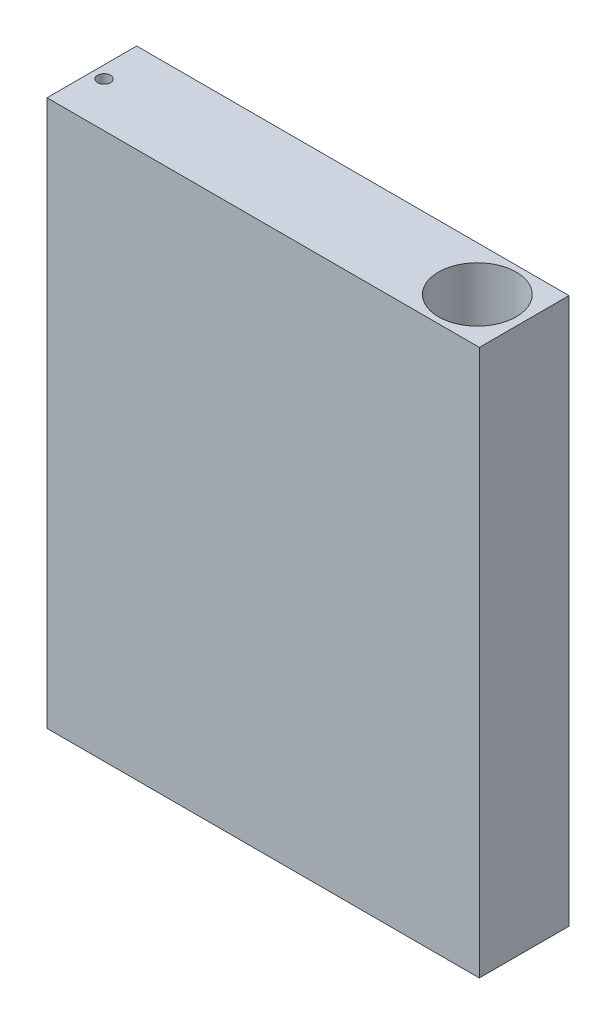
from build123d import *

# Parameters (mm, degrees)
SKETCH2_W           = 53.04
SKETCH2_H           = 11
BOSS_EXTRUDE1_DEPTH = 67
SKETCH3_R           = 4.765
CUT_EXTRUDE1_DEPTH  = 87.158235822
SKETCH4_R           = 0.795
CUT_EXTRUDE2_DEPTH  = 33.5


with BuildPart() as part:
    # Sketch2 → Boss-Extrude1 (new body)
    with BuildSketch(Plane(origin=(0, 0, 0), x_dir=(1, 0, 0), z_dir=(0, 1, 0))):
        with Locations((26.52, 5.5)):
            Rectangle(SKETCH2_W, SKETCH2_H)
    extrude(amount=BOSS_EXTRUDE1_DEPTH)

    # Sketch3 → Cut-Extrude1 (cut, through all)
    with BuildSketch(Plane(origin=(0, 67, 0), x_dir=(1, 0, 0), z_dir=(0, 1, 0))):
        with Locations(Location((47.29, 5.5, 0), (0, 0, 270))):
            Circle(SKETCH3_R)
    extrude(amount=-CUT_EXTRUDE1_DEPTH, mode=Mode.SUBTRACT)

    # Sketch4 → Cut-Extrude2 (cut)
    with BuildSketch(Plane(origin=(0, 67, 0), x_dir=(1, 0, 0), z_dir=(0, 1, 0))):
        with Locations(Location((1.5, 5.5, 0), (0, 0, 270))):
            Circle(SKETCH4_R)
    extrude(amount=-CUT_EXTRUDE2_DEPTH, mode=Mode.SUBTRACT)


solid = part.part
